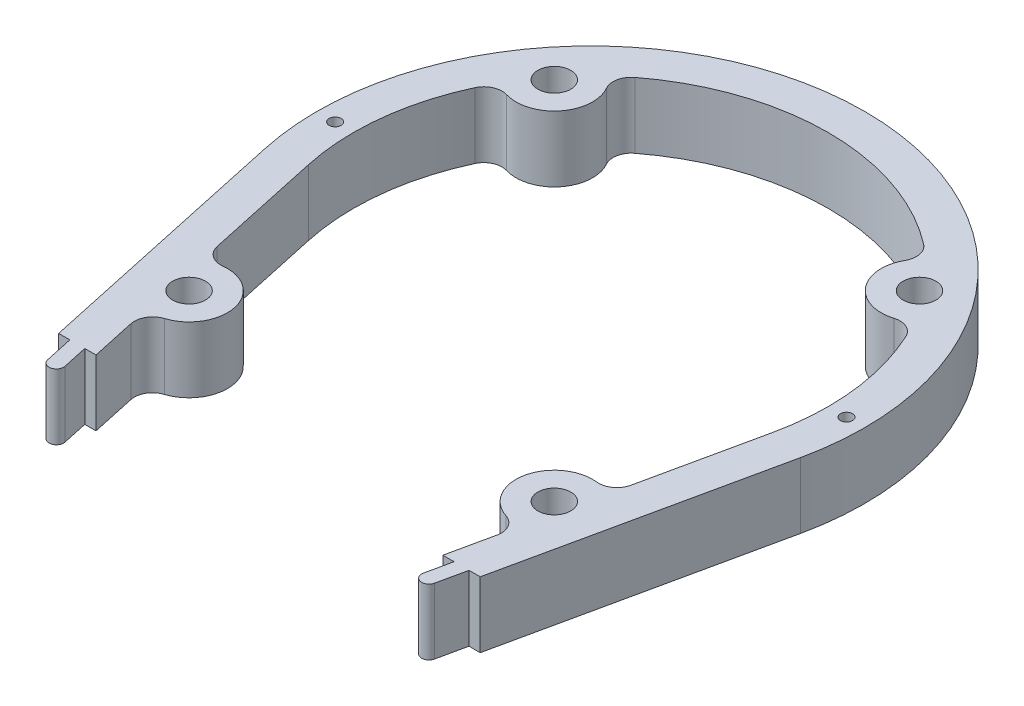
from build123d import *

# Parameters (mm, degrees)
SKETCH1_R           = 4.5
SKETCH1_R_2         = 1.65
BOSS_EXTRUDE1_DEPTH = 18


with BuildPart() as part:
    # Sketch1 → Boss-Extrude1 (new body)
    with BuildSketch(Plane(origin=(0, 0, 0), x_dir=(1, 0, 0), z_dir=(0, 1, 0))):
        with BuildLine():
            Line((-57.71713569, -88), (-54.647909803, -88))
            Line((-54.647909803, -88), (-52.972729242, -95.753217476))
            ThreePointArc((-52.972729242, -95.753217476), (-50.595460167, -97.285729058), (-49.062948585, -94.908459984))
            Line((-49.062948585, -94.908459984), (-50.555608621, -88))
            Line((-50.555608621, -88), (-47.486382735, -88))
            Line((-47.486382735, -88), (-50.121259231, -75.805033701))
            ThreePointArc((-50.121259231, -75.805033701), (-49.566331597, -72.252851185), (-46.771441988, -69.991316888))
            ThreePointArc((-46.771441988, -69.991316888), (-39.736825778, -57.782511582), (-51.184371295, -49.567010753))
            ThreePointArc((-51.184371295, -49.567010753), (-54.663630533, -48.661085559), (-56.635583446, -45.654867501))
            Line((-56.635583446, -45.654867501), (-63.533935661, -13.727309256))
            ThreePointArc((-63.533935661, -13.727309256), (-64.607519764, 7.132207931), (-59.0097537, 27.255255792))
            ThreePointArc((-59.0097537, 27.255255792), (-56.52196193, 29.718486659), (-53.028431594, 29.94621454))
            ThreePointArc((-53.028431594, 29.94621454), (-41.800877501, 33.440702001), (-40.856206486, 45.161495924))
            ThreePointArc((-40.856206486, 45.161495924), (-41.400905456, 48.61980725), (-39.543854024, 51.587630387))
            ThreePointArc((-39.543854024, 51.587630387), (0, 65), (39.543854024, 51.587630387))
            ThreePointArc((39.543854024, 51.587630387), (41.400905456, 48.61980725), (40.856206486, 45.161495924))
            ThreePointArc((40.856206486, 45.161495924), (41.800877501, 33.440702001), (53.028431594, 29.94621454))
            ThreePointArc((53.028431594, 29.94621454), (56.52196193, 29.718486659), (59.0097537, 27.255255792))
            ThreePointArc((59.0097537, 27.255255792), (64.607519764, 7.132207931), (63.533935661, -13.727309256))
            Line((63.533935661, -13.727309256), (56.635583446, -45.654867501))
            ThreePointArc((56.635583446, -45.654867501), (54.663630533, -48.661085559), (51.184371295, -49.567010753))
            ThreePointArc((51.184371295, -49.567010753), (39.736825778, -57.782511582), (46.771441988, -69.991316888))
            ThreePointArc((46.771441988, -69.991316888), (49.566331597, -72.252851185), (50.121259231, -75.805033701))
            Line((50.121259231, -75.805033701), (47.486382735, -88))
            Line((47.486382735, -88), (50.555608621, -88))
            Line((50.555608621, -88), (49.062948585, -94.908459984))
            ThreePointArc((49.062948585, -94.908459984), (50.595460167, -97.285729058), (52.972729242, -95.753217476))
            Line((52.972729242, -95.753217476), (54.647909803, -88))
            Line((54.647909803, -88), (57.71713569, -88))
            Line((57.71713569, -88), (73.308387301, -15.839202988))
            ThreePointArc((73.308387301, -15.839202988), (0, 75), (-73.308387301, -15.839202988))
            Line((-73.308387301, -15.839202988), (-57.71713569, -88))
        make_face()
        with Locations(Location((-50, -60, 0), (0, 0, 270))):
            Circle(SKETCH1_R, mode=Mode.SUBTRACT)
        with Locations(Location((50, -60, 0), (0, 0, 270))):
            Circle(SKETCH1_R, mode=Mode.SUBTRACT)
        with Locations(Location((70, 0, 0), (0, 0, 270))):
            Circle(SKETCH1_R_2, mode=Mode.SUBTRACT)
        with Locations(Location((50, 40, 0), (0, 0, 270))):
            Circle(SKETCH1_R, mode=Mode.SUBTRACT)
        with Locations(Location((-50, 40, 0), (0, 0, 270))):
            Circle(SKETCH1_R, mode=Mode.SUBTRACT)
        with Locations(Location((-70, 0, 0), (0, 0, 270))):
            Circle(SKETCH1_R_2, mode=Mode.SUBTRACT)
    extrude(amount=BOSS_EXTRUDE1_DEPTH)


solid = part.part
